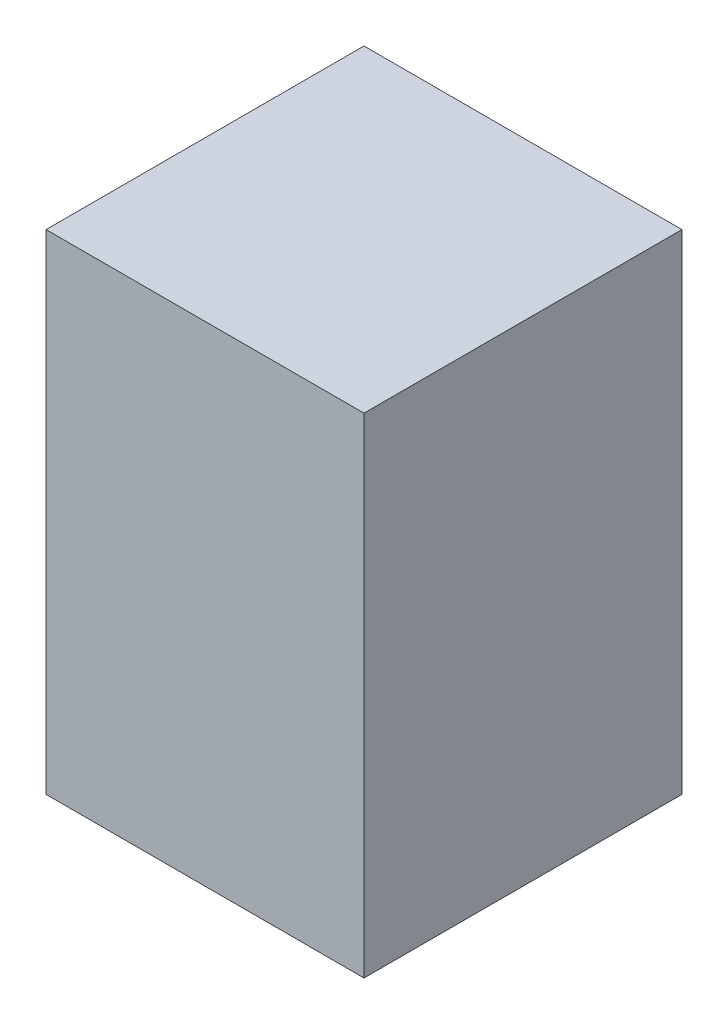
from build123d import *

# Parameters (mm, degrees)
SKETCH1_W           = 6.5
SKETCH1_H           = 6.5
BOSS_EXTRUDE1_DEPTH = 10


with BuildPart() as part:
    # Sketch1 → Boss-Extrude1 (new body)
    with BuildSketch(Plane(origin=(0, 0, 0), x_dir=(1, 0, 0), z_dir=(0, 1, 0))):
        with Locations((3.25, 3.25)):
            Rectangle(SKETCH1_W, SKETCH1_H)
    extrude(amount=BOSS_EXTRUDE1_DEPTH)


solid = part.part
